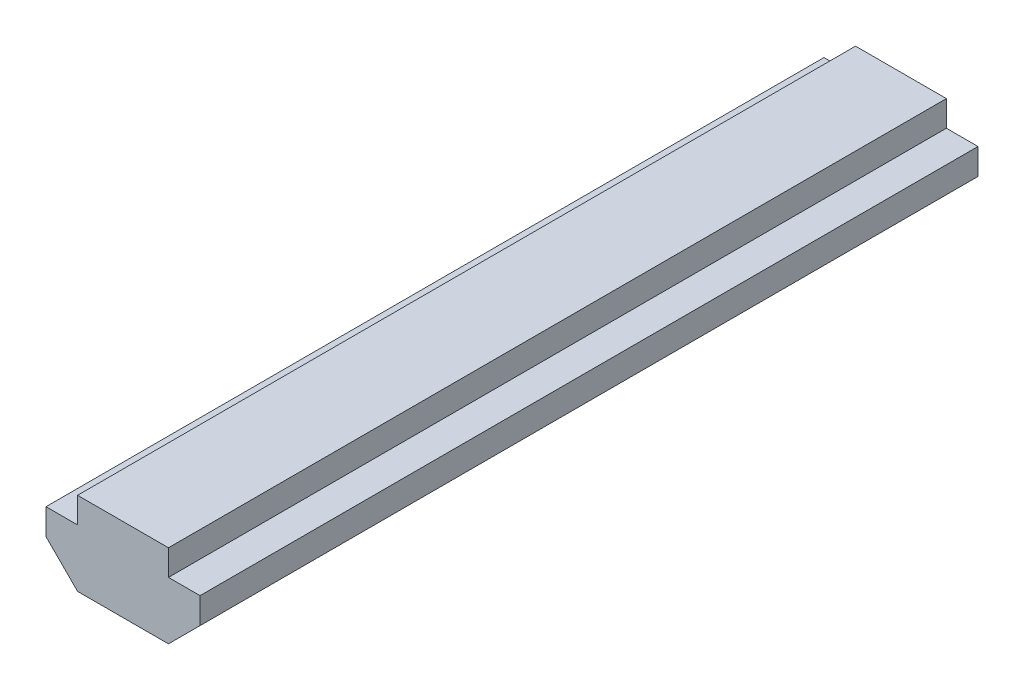
from build123d import *

# Parameters (mm, degrees)
EXTRUDE_1_DEPTH = 100


with BuildPart() as part:
    # 草图1 → 凸台-拉伸1 (new body)
    with BuildSketch(Plane.XY):
        Polygon((4.06, -7.4), (15.74, -7.4), (19.8, -3.34), (19.8, 0), (15.74, 0), (15.74, 3.3), (4.06, 3.3), (4.06, 0), (0, 0), (0, -3.34), align=None)
    extrude(amount=EXTRUDE_1_DEPTH)


solid = part.part
